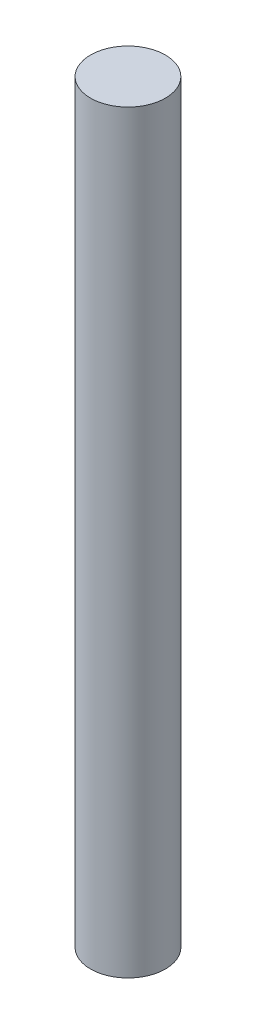
from build123d import *

# Parameters (mm, degrees)
SKETCH1_R           = 9.525
BOSS_EXTRUDE1_DEPTH = 192


with BuildPart() as part:
    # Sketch1 → Boss-Extrude1 (new body)
    with BuildSketch(Plane(origin=(0, 0, 0), x_dir=(1, 0, 0), z_dir=(0, 1, 0))):
        with Locations(Location((0, 0, 0), (0, 0, 270))):
            Circle(SKETCH1_R)
    extrude(amount=BOSS_EXTRUDE1_DEPTH)


solid = part.part
